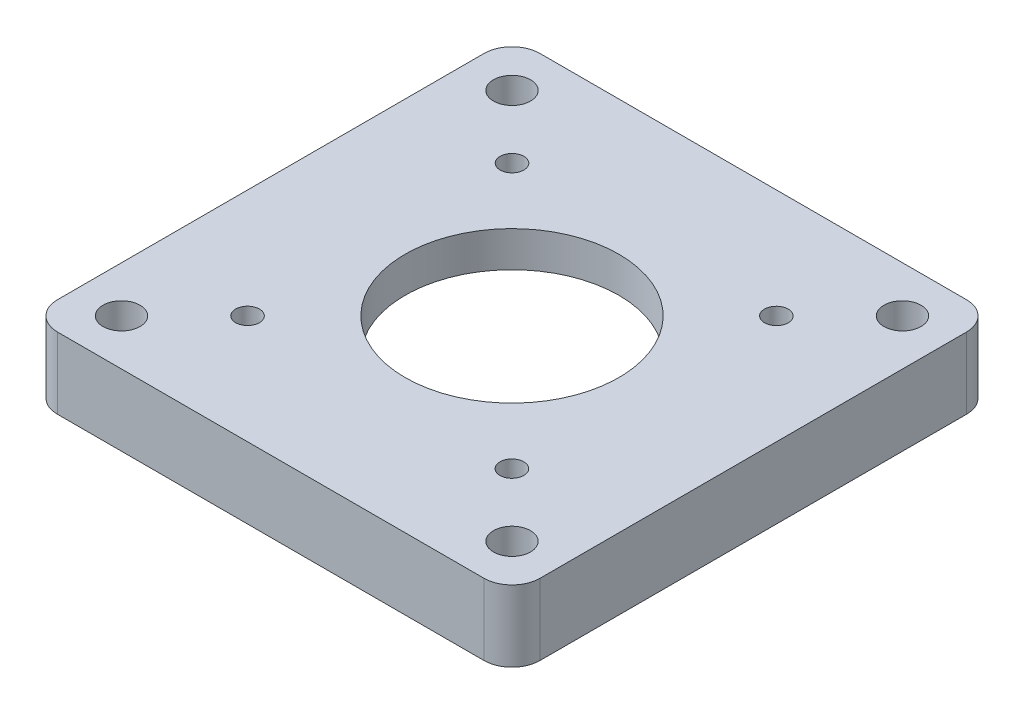
from build123d import *

# Parameters (mm, degrees)
SKETCH1_W                  = 86
SKETCH1_H                  = 86
BOSS_EXTRUDE1_DEPTH        = 12.7
CUT_EXTRUDE1_DEPTH         = 6.35
F_6_6_6_6_DIAMETER_HOLE1_D = 6.6
HOLE1_D                    = 4.234
M36_CLEARANCE_HOLE1_D      = 38.1
M36_CLEARANCE_HOLE1_DEPTH  = 12.7
FILLET1_R                  = 5


with BuildPart() as part:
    # Sketch1 → Boss-Extrude1 (new body)
    with BuildSketch(Plane(origin=(0, 6.35, 0), x_dir=(1, 0, 0), z_dir=(0, 1, 0))):
        Rectangle(SKETCH1_W, SKETCH1_H)
    extrude(amount=-BOSS_EXTRUDE1_DEPTH)

    # Sketch2 → Cut-Extrude1 (cut)
    with BuildSketch(Plane.XZ.offset(6.35)):
        with BuildLine():
            ThreePointArc((-30.319628177, -20.32166694), (-28.853300859, -28.853300859), (-20.32166694, -30.319628177))
            ThreePointArc((-20.32166694, -30.319628177), (0, -36.5), (20.32166694, -30.319628177))
            ThreePointArc((20.32166694, -30.319628177), (28.853300859, -28.853300859), (30.319628177, -20.32166694))
            ThreePointArc((30.319628177, -20.32166694), (36.5, 0), (30.319628177, 20.32166694))
            ThreePointArc((30.319628177, 20.32166694), (28.853300859, 28.853300859), (20.32166694, 30.319628177))
            ThreePointArc((20.32166694, 30.319628177), (0, 36.5), (-20.32166694, 30.319628177))
            ThreePointArc((-20.32166694, 30.319628177), (-28.853300859, 28.853300859), (-30.319628177, 20.32166694))
            ThreePointArc((-30.319628177, 20.32166694), (-36.5, 0), (-30.319628177, -20.32166694))
        make_face()
    extrude(amount=-CUT_EXTRUDE1_DEPTH, mode=Mode.SUBTRACT)

    # Ø6.6 (6.6) Diameter Hole1 (through all)
    with Locations(Plane(origin=(0, -6.35, 0), x_dir=(-1, 0, 0), z_dir=(0, -1, 0))):
        with Locations((-34.8, 34.8), (-34.8, -34.8), (34.8, -34.8), (34.8, 34.8)):
            Hole(F_6_6_6_6_DIAMETER_HOLE1_D / 2)

    # Hole1 (through all)
    with Locations(Plane(origin=(0, 0, 0), x_dir=(-1, 0, 0), z_dir=(0, -1, 0))):
        with Locations((23.57, -23.57), (-23.57, 23.55), (-23.57, -23.59), (23.57, 23.57)):
            Hole(HOLE1_D / 2)

    # M36 Clearance Hole1
    with Locations(Plane(origin=(0, 6.35, 0), x_dir=(1, 0, 0), z_dir=(0, 1, 0))):
        with Locations((0, 0)):
            Hole(M36_CLEARANCE_HOLE1_D / 2, depth=M36_CLEARANCE_HOLE1_DEPTH)

    # Fillet1
    fillet1_edges = [part.edges().sort_by_distance(p)[0] for p in [
        (43, 0, -43),
        (43, 0, 43),
        (-43, 0, 43),
        (-43, 0, -43),
    ]]
    fillet(fillet1_edges, radius=FILLET1_R)


solid = part.part
